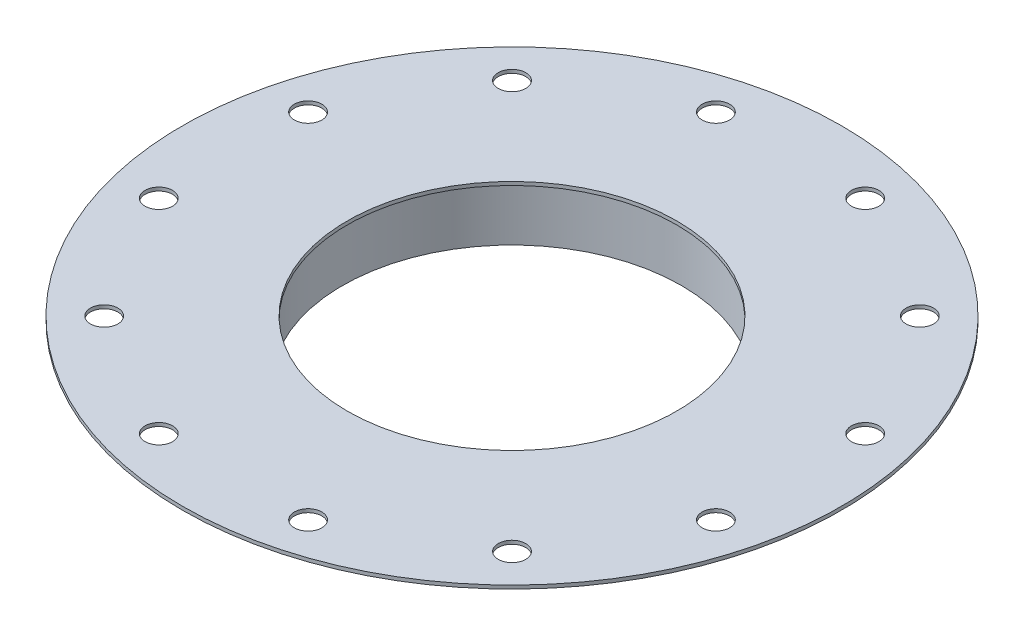
from build123d import *

# Parameters (mm, degrees)
BOSS_EXTRUDE1_DEPTH     = 6.35
CUT_EXTRUDE1_DEPTH      = 849.551897352
CUT_EXTRUDE1_DEPTH_BACK = 849.551897352
SKETCH2_R               = 25
SKETCH3_R               = 315
SKETCH3_R_2             = 308.65
BOSS_EXTRUDE2_DEPTH     = 100


with BuildPart() as part:
    # Sketch1 → Boss-Extrude1 (new body)
    with BuildSketch(Plane(origin=(0, 0, 0), x_dir=(1, 0, 0), z_dir=(0, 1, 0))):
        with BuildLine():
            Line((0, 450), (0, 300))
            ThreePointArc((0, 300), (212.132034356, 212.132034356), (300, 0))
            ThreePointArc((300, 0), (212.132034356, -212.132034356), (0, -300))
            Line((0, -300), (0, -450))
            ThreePointArc((0, -450), (318.198051534, -318.198051534), (450, 0))
            ThreePointArc((450, 0), (318.198051534, 318.198051534), (0, 450))
        make_face()
        with BuildLine():
            ThreePointArc((0, -450), (-450, 0), (0, 450))
            Line((0, 450), (0, 600))
            ThreePointArc((0, 600), (-600, 0), (0, -600))
            Line((0, -600), (0, -450))
        make_face()
        with BuildLine():
            Line((0, 600), (0, 450))
            ThreePointArc((0, 450), (318.198051534, 318.198051534), (450, 0))
            ThreePointArc((450, 0), (318.198051534, -318.198051534), (0, -450))
            Line((0, -450), (0, -600))
            ThreePointArc((0, -600), (424.264068712, -424.264068712), (600, 0))
            ThreePointArc((600, 0), (424.264068712, 424.264068712), (0, 600))
        make_face()
        with BuildLine():
            ThreePointArc((0, -300), (-300, 0), (0, 300))
            Line((0, 300), (0, 450))
            ThreePointArc((0, 450), (-450, 0), (0, -450))
            Line((0, -450), (0, -300))
        make_face()
    extrude(amount=BOSS_EXTRUDE1_DEPTH)

    # Sketch2 → Cut-Extrude1 (cut, two sides: drawn at the far end of the back side and taken through both)
    with BuildSketch(Plane(origin=(0, 6.35, 0), x_dir=(1, 0, 0), z_dir=(0, 1, 0)).offset(-CUT_EXTRUDE1_DEPTH_BACK)):
        with Locations(Location((135.879998679, 507.111058802, 0), (0, 0, 270))):
            Circle(SKETCH2_R)
        with Locations(Location((-135.879998679, 507.111058802, 0), (0, 0, 270))):
            Circle(SKETCH2_R)
        with Locations(Location((371.231060123, 371.231060123, 0), (0, 0, 270))):
            Circle(SKETCH2_R)
        with Locations(Location((507.111058802, 135.879998679, 0), (0, 0, 270))):
            Circle(SKETCH2_R)
        with Locations(Location((507.111058802, -135.879998679, 0), (0, 0, 270))):
            Circle(SKETCH2_R)
        with Locations(Location((371.231060123, -371.231060123, 0), (0, 0, 270))):
            Circle(SKETCH2_R)
        with Locations(Location((135.879998679, -507.111058802, 0), (0, 0, 270))):
            Circle(SKETCH2_R)
        with Locations(Location((-371.231060123, 371.231060123, 0), (0, 0, 270))):
            Circle(SKETCH2_R)
        with Locations(Location((-507.111058802, 135.879998679, 0), (0, 0, 270))):
            Circle(SKETCH2_R)
        with Locations(Location((-507.111058802, -135.879998679, 0), (0, 0, 270))):
            Circle(SKETCH2_R)
        with Locations(Location((-371.231060123, -371.231060123, 0), (0, 0, 270))):
            Circle(SKETCH2_R)
        with Locations(Location((-135.879998679, -507.111058802, 0), (0, 0, 270))):
            Circle(SKETCH2_R)
    extrude(amount=CUT_EXTRUDE1_DEPTH + CUT_EXTRUDE1_DEPTH_BACK, mode=Mode.SUBTRACT)

    # Sketch3 → Boss-Extrude2 (add)
    with BuildSketch(Plane.XZ):
        with Locations(Location((0, 0, 0), (0, 0, 90))):
            Circle(SKETCH3_R)
        with Locations(Location((0, 0, 0), (0, 0, 270))):
            Circle(SKETCH3_R_2, mode=Mode.SUBTRACT)
    extrude(amount=BOSS_EXTRUDE2_DEPTH)


solid = part.part
